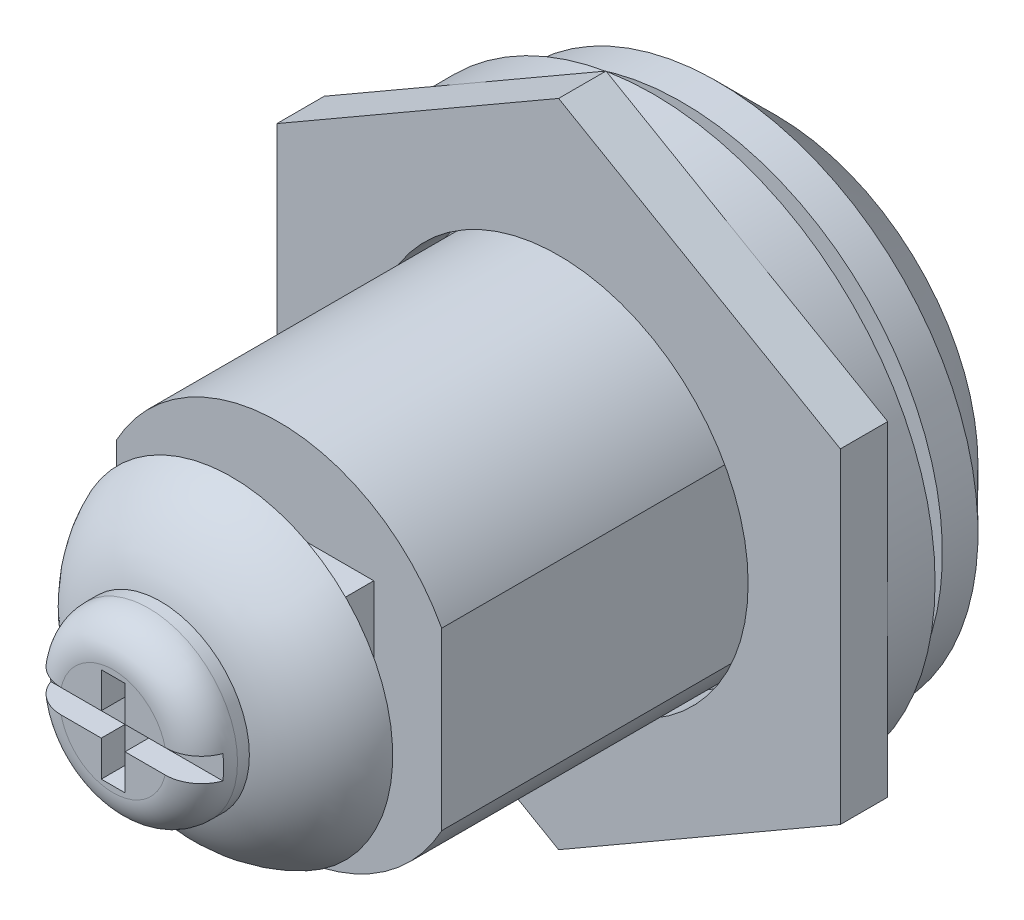
from build123d import *

# Parameters (mm, degrees)
EXTRUDE_1_DEPTH     = 17
SKETCH_3_R          = 11
EXTRUDE_2_DEPTH     = 4
CHAMFER_1_SIZE      = 2.5
SKETCH_5_W          = 8
SKETCH_5_H          = 8
EXTRUDE_4_DEPTH     = 2
SKETCH_6_R          = 2.5
EXTRUDE_5_DEPTH     = 3
SKETCH_7_R          = 3.75
EXTRUDE_6_DEPTH     = 2
FILLET_1_R          = 1.5
CUT_EXTRUDE_1_DEPTH = 1
SKETCH_9_R          = 8
EXTRUDE_7_DEPTH     = 2
SKETCH_10_W         = 2
SKETCH_10_H         = 7
CUT_EXTRUDE_2_DEPTH = 3
SKETCH_13_R         = 11.890098709
EXTRUDE_2_2_DEPTH   = 2


with BuildPart() as part:
    # 草图1 → 拉伸1 (new body)
    with BuildSketch(Plane.XY):
        with BuildLine():
            Line((6.86658576, 3.7), (6.86658576, -3.7))
            ThreePointArc((6.86658576, -3.7), (0, -7.8), (-6.86658576, -3.7))
            Line((-6.86658576, -3.7), (-6.86658576, 3.7))
            ThreePointArc((-6.86658576, 3.7), (0, 7.8), (6.86658576, 3.7))
        make_face()
    extrude(amount=EXTRUDE_1_DEPTH)

    # 草图3 → Extrude 2 (add)
    with BuildSketch(Plane(origin=(0, 0, 0), x_dir=(-1, 0, 0), z_dir=(0, 0, -1))):
        Circle(SKETCH_3_R)
    extrude(amount=EXTRUDE_2_DEPTH)

    # 倒角1
    chamfer_1_edges = [part.edges().sort_by_distance(p)[0] for p in [
        (11, 0, -4),
    ]]
    chamfer(chamfer_1_edges, length=CHAMFER_1_SIZE)

    # 草图5 → 拉伸4 (add)
    with BuildSketch(Plane.XY.offset(17)):
        Rectangle(SKETCH_5_W, SKETCH_5_H)
    extrude(amount=EXTRUDE_4_DEPTH)

    # 草图6 → 拉伸5 (add)
    with BuildSketch(Plane.XY.offset(19)):
        Circle(SKETCH_6_R)
    extrude(amount=EXTRUDE_5_DEPTH)

    # 草图7 → 拉伸6 (add)
    with BuildSketch(Plane.XY.offset(22)):
        Circle(SKETCH_7_R)
    extrude(amount=EXTRUDE_6_DEPTH)

    # 圆角1
    fillet_1_edges = [part.edges().sort_by_distance(p)[0] for p in [
        (-3.75, 0, 24),
    ]]
    fillet(fillet_1_edges, radius=FILLET_1_R)

    # 草图8 → 切除-拉伸1 (cut)
    with BuildSketch(Plane.XY.offset(24)):
        Polygon((-4.5, 0.5), (-0.5, 0.5), (-0.5, 2), (0.5, 2), (0.5, 0.5), (4.5, 0.5), (4.5, -0.5), (0.5, -0.5), (0.5, -2), (-0.5, -2), (-0.5, -0.5), (-4.5, -0.5), align=None)
    extrude(amount=-CUT_EXTRUDE_1_DEPTH, mode=Mode.SUBTRACT)

    # 草图10 → 切除-拉伸2 (cut)
    with BuildSketch(Plane(origin=(0, 0, -4), x_dir=(-1, 0, 0), z_dir=(0, 0, -1))):
        Rectangle(SKETCH_10_W, SKETCH_10_H)
    extrude(amount=-CUT_EXTRUDE_2_DEPTH, mode=Mode.SUBTRACT)

    # 草图12 → 旋转2 (revolve)
    with BuildSketch(Plane(origin=(0, 0, 0), x_dir=(0, 0, -1), z_dir=(1, 0, 0)), mode=Mode.PRIVATE) as revolve_2_sk:
        with BuildLine():
            Line((-19, 0), (-19, -6.8))
            ThreePointArc((-19, -6.8), (-21.181245185, -5.004163457), (-22, -2.3))
            Line((-22, -2.3), (-22, 0))
            Line((-22, 0), (-19, 0))
        make_face()
    revolve(revolve_2_sk.sketch.rotate(Axis((0, 0, 0), (0, 0, 1)), 270), axis=Axis((0, 0, 0), (0, 0, 1)))



with BuildPart() as body_2:
    # 草图9 → 拉伸7 (new body)
    with BuildSketch(Plane.XY.offset(3.2)):
        Polygon((11.890098709, -6.86475169), (0, -13.72950338), (-11.890098709, -6.86475169), (-11.890098709, 6.86475169), (0, 13.72950338), (11.890098709, 6.86475169), align=None)
        Circle(SKETCH_9_R, mode=Mode.SUBTRACT)
    extrude(amount=EXTRUDE_7_DEPTH)


with BuildPart() as part_1:
    add(part.part)

    add(body_2.part)  # Extrude 2 2 merges body 2
    # 草图13 → Extrude 2 2 (add)
    with BuildSketch(Plane(origin=(0, 0, 3.2), x_dir=(-1, 0, 0), z_dir=(0, 0, -1))):
        Circle(SKETCH_13_R)
    extrude(amount=EXTRUDE_2_2_DEPTH)


solid = part_1.part
